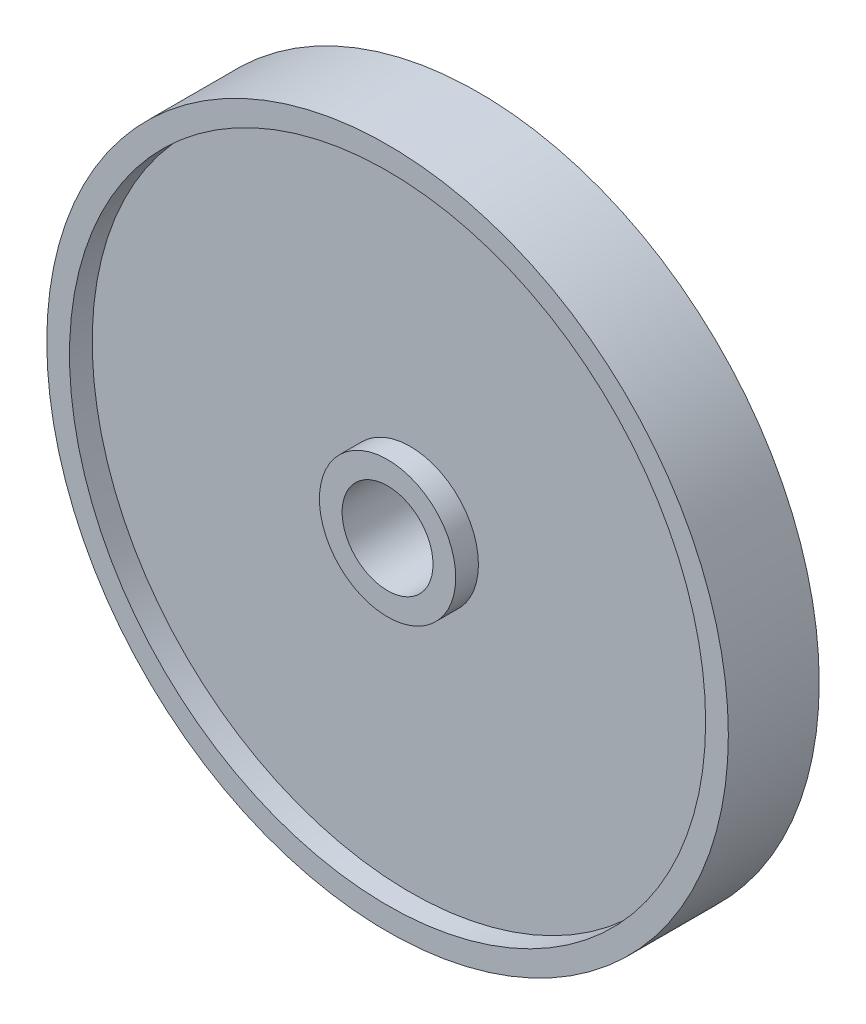
from build123d import *

# Parameters (mm, degrees)
SKETCH1_R           = 37.5
SKETCH1_R_2         = 5
BOSS_EXTRUDE1_DEPTH = 10
SKETCH2_R           = 35
SKETCH2_R_2         = 7.5
CUT_EXTRUDE1_DEPTH  = 2.5
CUT_EXTRUDE2_START  = -2.5
SKETCH3_R           = 35
SKETCH3_R_2         = 7.5
CUT_EXTRUDE2_DEPTH  = 2.5


with BuildPart() as part:
    # Sketch1 → Boss-Extrude1 (new body)
    with BuildSketch(Plane.XY):
        Circle(SKETCH1_R)
        Circle(SKETCH1_R_2, mode=Mode.SUBTRACT)
    extrude(amount=BOSS_EXTRUDE1_DEPTH)

    # Sketch2 → Cut-Extrude1 (cut)
    with BuildSketch(Plane.XY.offset(10)):
        Circle(SKETCH2_R)
        Circle(SKETCH2_R_2, mode=Mode.SUBTRACT)
    extrude(amount=-CUT_EXTRUDE1_DEPTH, mode=Mode.SUBTRACT)

    # Sketch3 → Cut-Extrude2 (cut)
    with BuildSketch(Plane(origin=(0, 0, 0), x_dir=(-1, 0, 0), z_dir=(0, 0, -1)).offset(CUT_EXTRUDE2_START)):
        with Locations(Location((0, 0, 0), (0, 0, 180))):
            Circle(SKETCH3_R)
        with Locations(Location((0, 0, 0), (0, 0, 180))):
            Circle(SKETCH3_R_2, mode=Mode.SUBTRACT)
    extrude(amount=CUT_EXTRUDE2_DEPTH, mode=Mode.SUBTRACT)


solid = part.part
